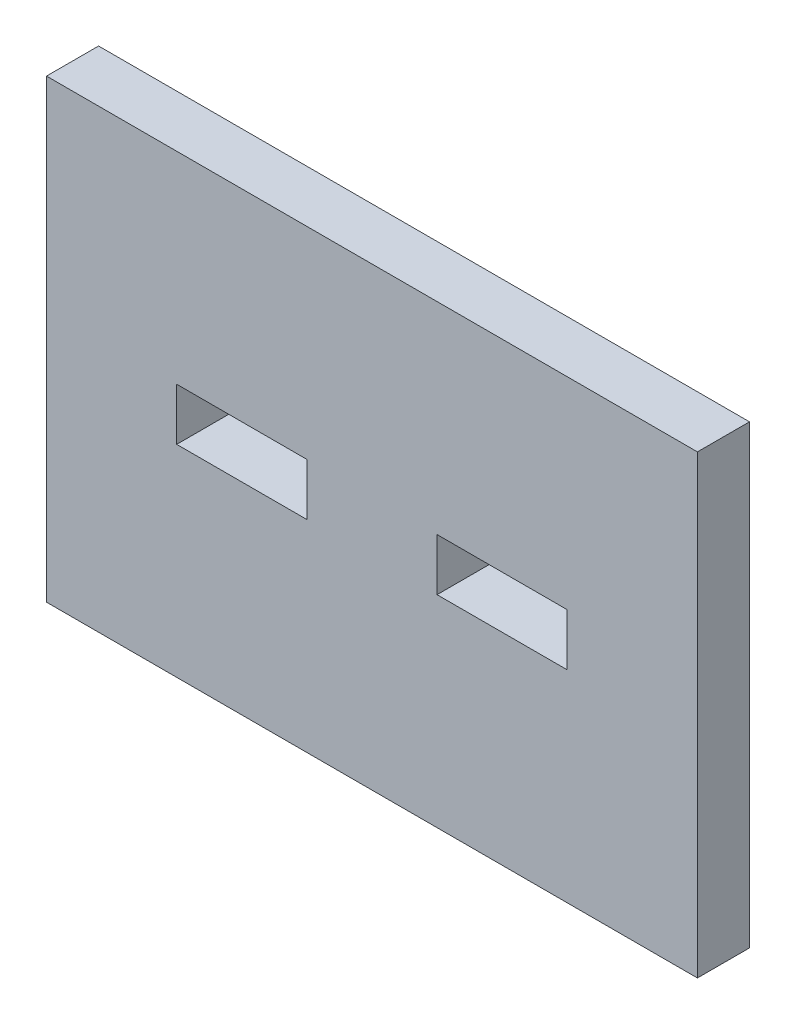
from build123d import *

# Parameters (mm, degrees)
SKETCH1_W           = 50
SKETCH1_H           = 35
BOSS_EXTRUDE1_DEPTH = 4
SKETCH2_W           = 10
SKETCH2_H           = 4
CUT_EXTRUDE1_DEPTH  = 4


with BuildPart() as part:
    # Sketch1 → Boss-Extrude1 (new body)
    with BuildSketch(Plane.XY):
        with Locations((25, 17.5)):
            Rectangle(SKETCH1_W, SKETCH1_H)
    extrude(amount=BOSS_EXTRUDE1_DEPTH)

    # Sketch2 → Cut-Extrude1 (cut)
    with BuildSketch(Plane.XY.offset(4)):
        with Locations((15, 17.5)):
            Rectangle(SKETCH2_W, SKETCH2_H)
        with Locations((35, 17.5)):
            Rectangle(SKETCH2_W, SKETCH2_H)
    extrude(amount=-CUT_EXTRUDE1_DEPTH, mode=Mode.SUBTRACT)


solid = part.part
